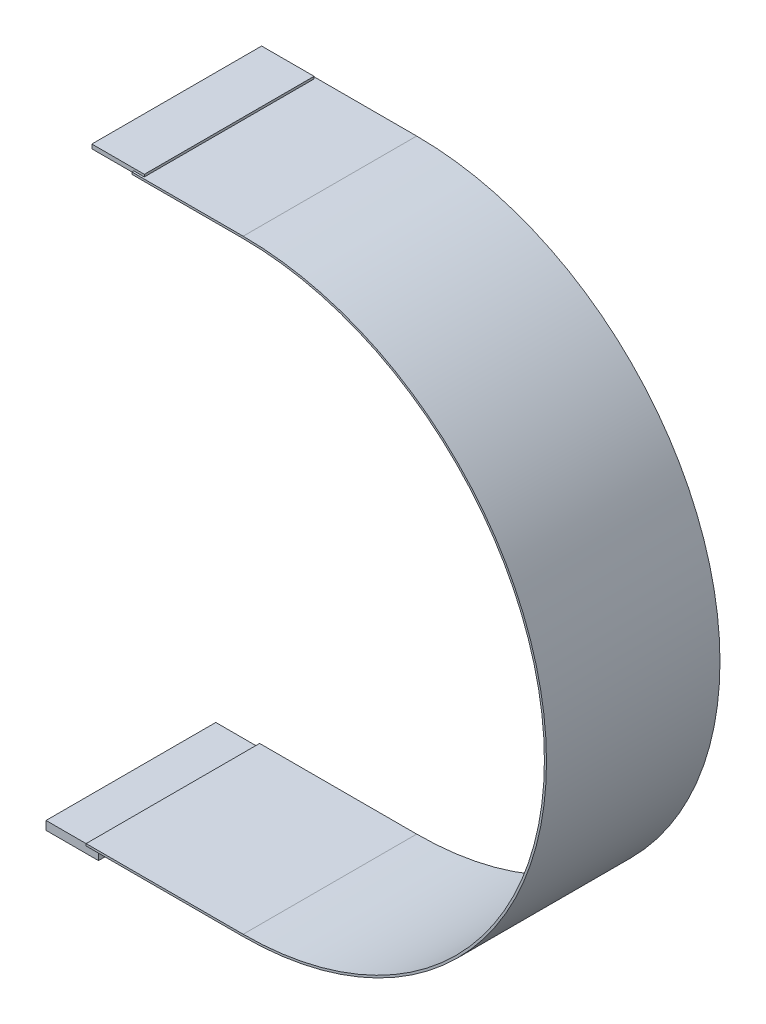
from build123d import *

# Parameters (mm, degrees)
BOSS_EXTRUDE1_DEPTH      = 10.5
BOSS_EXTRUDE2_DEPTH      = 5.08
BOSS_EXTRUDE2_DEPTH_BACK = 1.27
SKETCH3_W                = 20.5486
SKETCH3_H                = 1.0414
BOSS_EXTRUDE3_DEPTH      = 5.08
BOSS_EXTRUDE3_DEPTH_BACK = 1.27
SKETCH4_W                = 20.5486
SKETCH4_H                = 0.508


with BuildPart() as part:
    # Sketch1 → Boss-Extrude1 (new, symmetric)
    with BuildSketch(Plane.XY):
        with BuildLine():
            Line((0, 0), (19.01175011, 0))
            ThreePointArc((19.01175011, 0), (55.726625118, 36.714875008), (19.01175011, 73.429750016))
            Line((19.01175011, 73.429750016), (5.549000018, 73.429750016))
            Line((5.549000018, 73.429750016), (5.549000018, 73.175750016))
            Line((5.549000018, 73.175750016), (19.01175011, 73.175750016))
            ThreePointArc((19.01175011, 73.175750016), (55.472625118, 36.714875008), (19.01175011, 0.254))
            Line((19.01175011, 0.254), (0, 0.254))
            Line((0, 0.254), (0, 0))
        make_face()
    extrude(amount=BOSS_EXTRUDE1_DEPTH, both=True)

    # Sketch3 → Boss-Extrude2 (add, two sides: drawn at the far end of the back side and taken through both)
    with BuildSketch(Plane.ZY.offset(-BOSS_EXTRUDE2_DEPTH_BACK)):
        with Locations((0, -0.4953)):
            Rectangle(SKETCH3_W, SKETCH3_H)
    extrude(amount=BOSS_EXTRUDE2_DEPTH + BOSS_EXTRUDE2_DEPTH_BACK)

    # Sketch4 → Boss-Extrude3 (add, two sides: drawn at the far end of the back side and taken through both)
    with BuildSketch(Plane.ZY.offset(-5.549000018).offset(-BOSS_EXTRUDE3_DEPTH_BACK)):
        with Locations((0, 73.455150016)):
            Rectangle(SKETCH4_W, SKETCH4_H)
    extrude(amount=BOSS_EXTRUDE3_DEPTH + BOSS_EXTRUDE3_DEPTH_BACK)


solid = part.part
